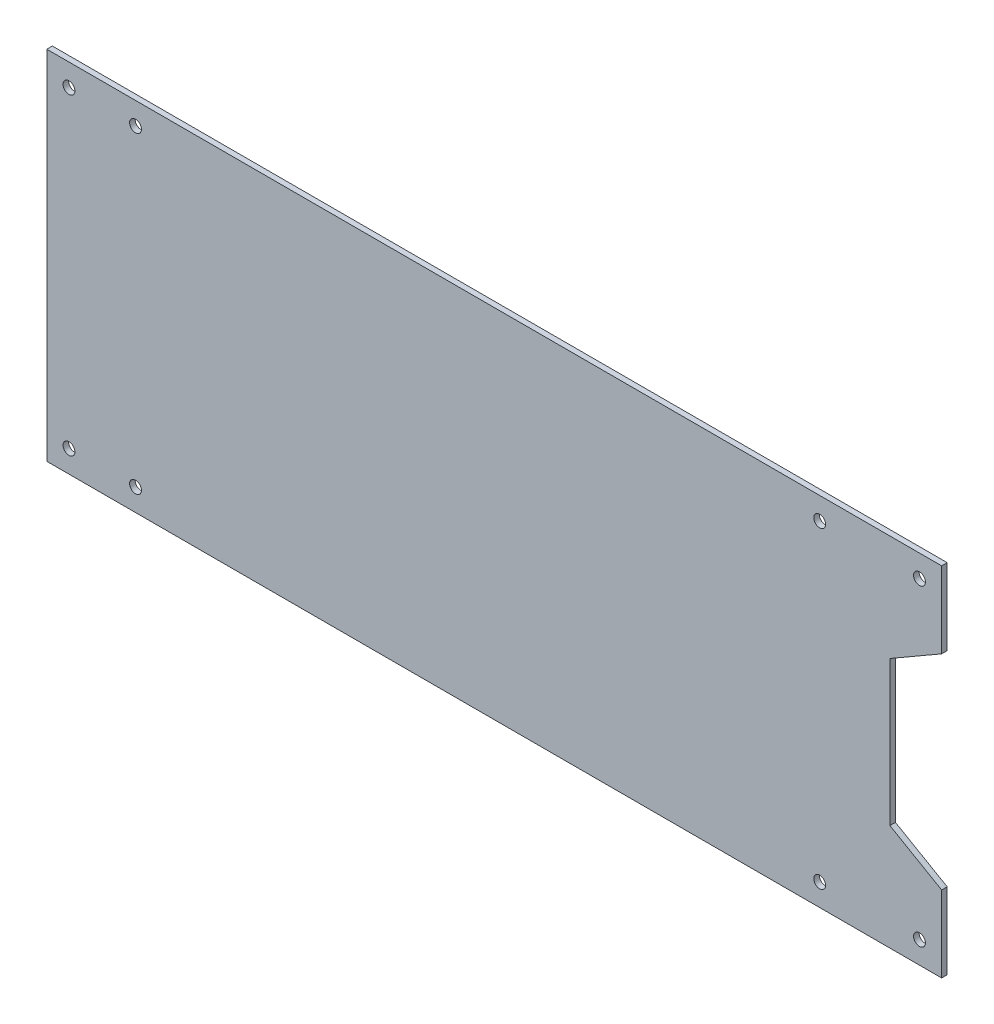
from build123d import *

# Parameters (mm, degrees)
BOSS_EXTRUDE1_DEPTH = 1.5
SKETCH2_R           = 1.6
CUT_EXTRUDE1_DEPTH  = 3.5


with BuildPart() as part:
    # Sketch1 → Boss-Extrude1 (new body)
    with BuildSketch(Plane.XY):
        Polygon((-586.414001465, 608.080871166), (-828.47776474, 608.080871166), (-828.47776474, 511.530029297), (-586.414001465, 511.530029297), (-586.414001465, 532.14883145), (-600.414001465, 540.231735219), (-600.414001465, 579.379165244), (-586.414001465, 587.462069012), align=None)
    extrude(amount=BOSS_EXTRUDE1_DEPTH)

    # Sketch2 → Cut-Extrude1 (cut)
    with BuildSketch(Plane.XY.offset(1.5)):
        with Locations((-822.47776474, 602.080871166)):
            Circle(SKETCH2_R)
        with Locations((-804.47776474, 602.080871166)):
            Circle(SKETCH2_R)
        with Locations((-822.47776474, 517.530029297)):
            Circle(SKETCH2_R)
        with Locations((-804.47776474, 517.530029297)):
            Circle(SKETCH2_R)
        with Locations((-619.414001465, 602.080871166)):
            Circle(SKETCH2_R)
        with Locations((-592.414001465, 602.080871166)):
            Circle(SKETCH2_R)
        with Locations((-619.414001465, 517.530029297)):
            Circle(SKETCH2_R)
        with Locations((-592.414001465, 517.530029297)):
            Circle(SKETCH2_R)
    extrude(amount=-CUT_EXTRUDE1_DEPTH, mode=Mode.SUBTRACT)


solid = part.part
